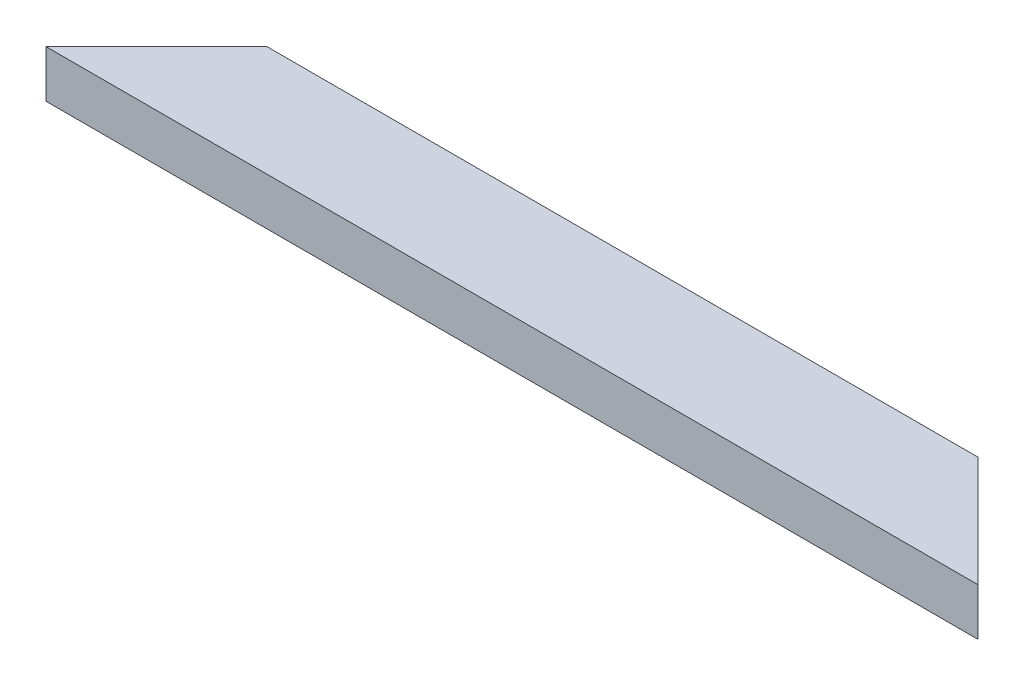
from build123d import *

# Parameters (mm, degrees)
BOSS_EXTRUDE1_DEPTH = 38.1


with BuildPart() as part:
    # Sketch1 → Boss-Extrude1 (new body)
    with BuildSketch(Plane(origin=(0, 0, 0), x_dir=(1, 0, 0), z_dir=(0, 1, 0))):
        Polygon((0, 0), (750, 0), (661.1, 88.9), (88.9, 88.9), align=None)
    extrude(amount=BOSS_EXTRUDE1_DEPTH)


solid = part.part
